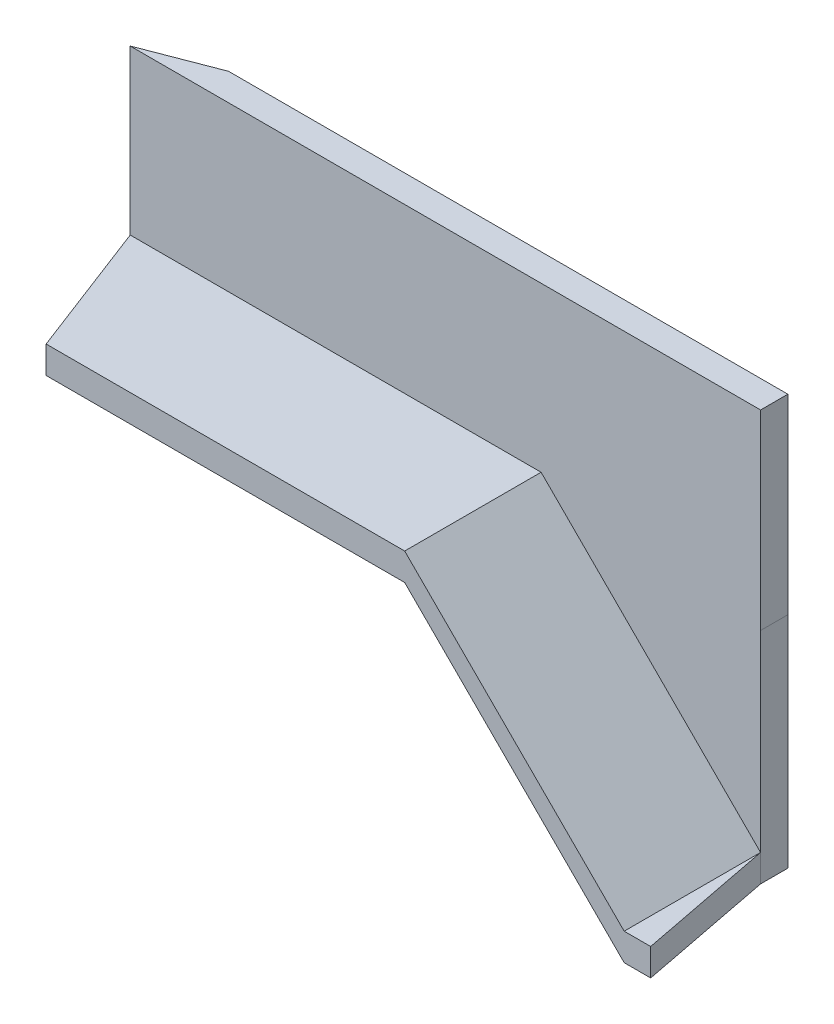
from build123d import *

# Parameters (mm, degrees)
SKETCH1_W               = 69
SKETCH1_H               = 14
BOSS_EXTRUDE1_DEPTH     = 2
SKETCH2_W               = 52.910547302
SKETCH2_H               = 2
BOSS_EXTRUDE2_DEPTH     = 4
CUT_EXTRUDE1_DEPTH      = 20
CUT_EXTRUDE1_DEPTH_BACK = 20
CUT_EXTRUDE2_DEPTH      = 2
BOSS_EXTRUDE3_DEPTH     = 2
BOSS_EXTRUDE4_DEPTH     = 4
BOSS_EXTRUDE5_DEPTH     = 6
CUT_EXTRUDE3_DEPTH      = 6
BOSS_EXTRUDE6_START     = -16.09
BOSS_EXTRUDE6_DEPTH     = 2
CUT_EXTRUDE4_DEPTH      = 20
CUT_EXTRUDE4_DEPTH_BACK = 20
SKETCH11_W              = 60.759047224
SKETCH11_H              = 31.87532725


with BuildPart() as part:
    # Sketch1 → Boss-Extrude1 (new body)
    with BuildSketch(Plane.XY):
        with Locations((-11.678861789, -0.654471545)):
            Rectangle(SKETCH1_W, SKETCH1_H)
    extrude(amount=BOSS_EXTRUDE1_DEPTH)

    # Sketch2 → Boss-Extrude2 (add)
    with BuildSketch(Plane.XY.offset(2)):
        with Locations((-19.723588138, 5.345528455)):
            Rectangle(SKETCH2_W, SKETCH2_H)
    extrude(amount=BOSS_EXTRUDE2_DEPTH)

    # Sketch4 → Cut-Extrude1 (cut, two sides: drawn at the far end of the back side and taken through both)
    with BuildSketch(Plane(origin=(0, 6.345528455, 0), x_dir=(1, 0, 0), z_dir=(0, 1, 0)).offset(-CUT_EXTRUDE1_DEPTH_BACK)):
        Polygon((-18.178861789, 0), (-33.809396177, -6), (-46.178861789, -6), (-46.178861789, 0), align=None)
    extrude(amount=CUT_EXTRUDE1_DEPTH + CUT_EXTRUDE1_DEPTH_BACK, mode=Mode.SUBTRACT)

    # Sketch5 → Cut-Extrude2 (cut)
    with BuildSketch(Plane(origin=(0, 6.345528455, 0), x_dir=(1, 0, 0), z_dir=(0, 1, 0))):
        Polygon((-33.809396177, -6), (-23.38959077, -2.000211452), (-21.854215798, -6), align=None)
    extrude(amount=-CUT_EXTRUDE2_DEPTH, mode=Mode.SUBTRACT)

    # Sketch6 → Boss-Extrude3 (add)
    with BuildSketch(Plane.XY.offset(2)):
        Polygon((6.731685513, 6.345528455), (22.821685513, 22.435528455), (22.821138211, 6.345528455), align=None)
    extrude(amount=-BOSS_EXTRUDE3_DEPTH)

    # Sketch7 → Boss-Extrude4 (add)
    with BuildSketch(Plane.XY.offset(2)):
        Polygon((6.731685513, 4.345528455), (22.821617483, 20.435528456), (22.821685513, 22.435528455), (6.731685513, 6.345528455), align=None)
    extrude(amount=BOSS_EXTRUDE4_DEPTH)

    # Sketch8 → Boss-Extrude5 (add)
    with BuildSketch(Plane.XY.offset(6)):
        Polygon((22.821685513, 22.435528455), (6.731685513, 6.345528455), (-21.854215798, 6.345528455), (-21.854215798, 4.345528455), (6.731685513, 4.345528455), (22.821617483, 20.435528456), align=None)
    extrude(amount=BOSS_EXTRUDE5_DEPTH)

    # Sketch9 → Cut-Extrude3 (cut)
    with BuildSketch(Plane.XZ.offset(-4.345528455)):
        Polygon((-23.389039918, 2), (-21.854215798, 6), (-19.551979619, 12), (-21.854215798, 12), align=None)
    extrude(amount=-CUT_EXTRUDE3_DEPTH, mode=Mode.SUBTRACT)


with BuildPart() as cut_extrude3_piece_1:
    # of the separate pieces the step leaves, piece 1, a body of its own (cut_extrude3_pieces)
    add(part.part.solids().sort_by_distance((-18.178861789, 6.345528455, 0))[0])

    # Sketch10 → Boss-Extrude6 (add)
    with BuildSketch(Plane.XZ.offset(-4.345528455).offset(BOSS_EXTRUDE6_START)):
        Polygon((22.821617483, 12), (24.765438688, 12), (22.821138211, 2), align=None)
    extrude(amount=-BOSS_EXTRUDE6_DEPTH)


with BuildPart() as cut_extrude3_piece_2:
    # of the separate pieces the step leaves, piece 2, a body of its own (cut_extrude3_pieces)
    add(part.part.solids().sort_by_distance((-23.38861886, 6.345528455, 2.002743364))[0])


with BuildPart() as body_3:
    # Mirror1: mirrored copy
    add(cut_extrude3_piece_1.part.mirror(Plane(origin=(-46.178861789, -7.654471545, 2), x_dir=(0, 0, 1), z_dir=(0, 1, 0))))


with BuildPart() as cut_extrude4_tool:
    # Sketch11 → Cut-Extrude4 (new, two sides: drawn at the far end of the back side and taken through both)
    with BuildSketch(Plane.XY.offset(2).offset(-CUT_EXTRUDE4_DEPTH_BACK)):
        with Locations((3.114590222, 8.28319208)):
            Rectangle(SKETCH11_W, SKETCH11_H)
    extrude(amount=CUT_EXTRUDE4_DEPTH + CUT_EXTRUDE4_DEPTH_BACK)


with BuildPart() as cut_extrude3_piece_1_1:
    add(cut_extrude3_piece_1.part)

    # Cut-Extrude4: cut by cut_extrude4_tool
    add(cut_extrude4_tool.part, mode=Mode.SUBTRACT)


with BuildPart() as cut_extrude3_piece_2_1:
    add(cut_extrude3_piece_2.part)

    # Cut-Extrude4: cut by cut_extrude4_tool
    add(cut_extrude4_tool.part, mode=Mode.SUBTRACT)


solid = body_3.part
